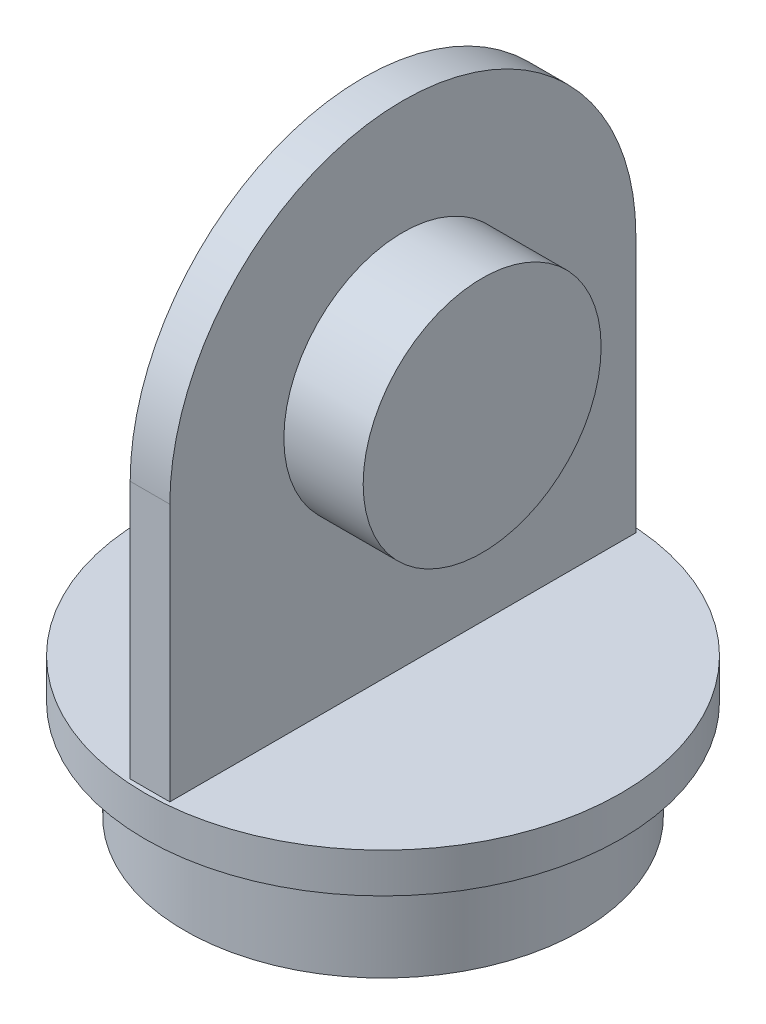
from build123d import *

# Parameters (mm, degrees)
SKETCH1_R           = 12
BOSS_EXTRUDE1_DEPTH = 2
BOSS_EXTRUDE2_DEPTH = 1
SKETCH3_R           = 10
BOSS_EXTRUDE3_DEPTH = 5
SKETCH5_R           = 6
BOSS_EXTRUDE6_DEPTH = 5
SCALE1_SCALE        = 2


with BuildPart() as part:
    # Sketch1 → Boss-Extrude1 (new body)
    with BuildSketch(Plane(origin=(0, 0, 0), x_dir=(1, 0, 0), z_dir=(0, 1, 0))):
        with Locations(Location((0, 0, 0), (0, 0, 270))):
            Circle(SKETCH1_R)
    extrude(amount=BOSS_EXTRUDE1_DEPTH)

    # Sketch2 → Boss-Extrude2 (add, symmetric)
    with BuildSketch(Plane(origin=(0, 0, 0), x_dir=(0, 0, -1), z_dir=(1, 0, 0))):
        with BuildLine():
            Line((-11.75, 2), (-11.75, 15))
            ThreePointArc((-11.75, 15), (0, 26.75), (11.75, 15))
            Line((11.75, 15), (11.75, 2))
            Line((11.75, 2), (-11.75, 2))
        make_face()
    extrude(amount=BOSS_EXTRUDE2_DEPTH, both=True)

    # Sketch3 → Boss-Extrude3 (add)
    with BuildSketch(Plane.XZ):
        with Locations(Location((0, 0, 0), (0, 0, 270))):
            Circle(SKETCH3_R)
    extrude(amount=BOSS_EXTRUDE3_DEPTH)

    # Sketch5 → Boss-Extrude6 (add, symmetric)
    with BuildSketch(Plane(origin=(0, 0, 0), x_dir=(0, 0, -1), z_dir=(1, 0, 0))):
        with Locations(Location((0, 15, 0), (0, 0, 180))):
            Circle(SKETCH5_R)
    extrude(amount=BOSS_EXTRUDE6_DEPTH, both=True)


with BuildPart() as part_1:
    # Scale1: scaled about (0, 5.516721754, 0)
    add(part.part.scale(SCALE1_SCALE).moved(Location((0, -5.516721754, 0))))


solid = part_1.part
